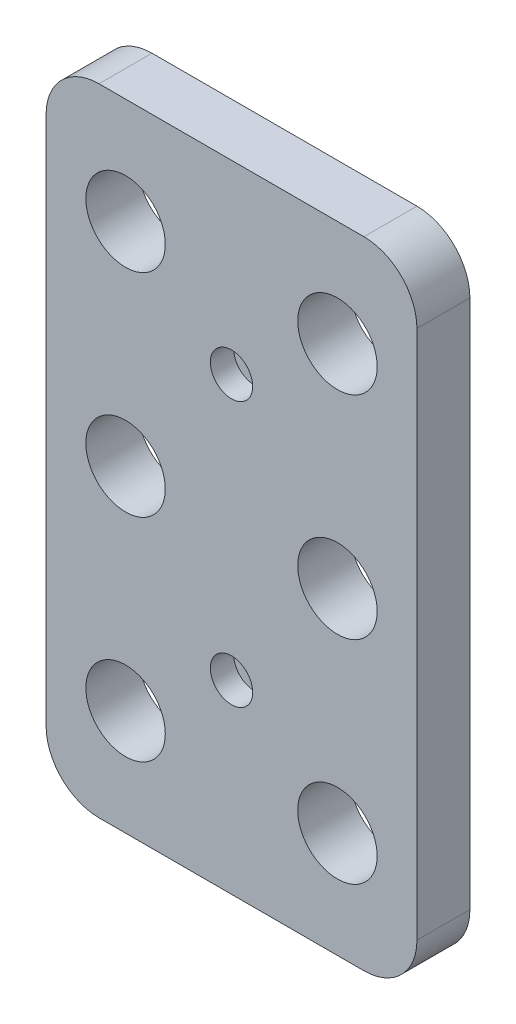
from build123d import *

# Parameters (mm, degrees)
SKETCH_1_R          = 7.5
SKETCH_1_R_2        = 2.25
EXTRUDE_1_DEPTH     = 10
SKETCH_2_R          = 4
CUT_EXTRUDE_1_DEPTH = 4.4
SHELL_1_T           = -3


with BuildPart() as part:
    # 草图1 → 凸台-拉伸1 (new body)
    with BuildSketch(Plane.XY):
        with BuildLine():
            Line((-25, -60), (25, -60))
            ThreePointArc((25, -60), (32.071067812, -57.071067812), (35, -50))
            Line((35, -50), (35, 50))
            ThreePointArc((35, 50), (32.071067812, 57.071067812), (25, 60))
            Line((25, 60), (-25, 60))
            ThreePointArc((-25, 60), (-32.071067812, 57.071067812), (-35, 50))
            Line((-35, 50), (-35, -50))
            ThreePointArc((-35, -50), (-32.071067812, -57.071067812), (-25, -60))
        make_face()
        with Locations((20, 40)):
            Circle(SKETCH_1_R, mode=Mode.SUBTRACT)
        with Locations((20, 0)):
            Circle(SKETCH_1_R, mode=Mode.SUBTRACT)
        with Locations(Location((20, -40, 0), (0, 0, 180))):
            Circle(SKETCH_1_R, mode=Mode.SUBTRACT)
        with Locations((-20, -40)):
            Circle(SKETCH_1_R, mode=Mode.SUBTRACT)
        with Locations(Location((-20, 0, 0), (0, 0, 180))):
            Circle(SKETCH_1_R, mode=Mode.SUBTRACT)
        with Locations(Location((-20, 40, 0), (0, 0, 180))):
            Circle(SKETCH_1_R, mode=Mode.SUBTRACT)
        with Locations((0, 25)):
            Circle(SKETCH_1_R_2, mode=Mode.SUBTRACT)
        with Locations(Location((0, -25, 0), (0, 0, 180))):
            Circle(SKETCH_1_R_2, mode=Mode.SUBTRACT)
    extrude(amount=EXTRUDE_1_DEPTH)

    # 草图2 → 切除-拉伸1 (cut)
    with BuildSketch(Plane.XY.offset(10)):
        with Locations((0, 25)):
            Circle(SKETCH_2_R)
        with Locations((0, -25)):
            Circle(SKETCH_2_R)
    extrude(amount=-CUT_EXTRUDE_1_DEPTH, mode=Mode.SUBTRACT)

    # 抽壳1
    shell_1_openings = [part.faces().sort_by_distance(p)[0] for p in [
        (0, 0, 0),
    ]]
    offset(amount=SHELL_1_T, openings=shell_1_openings, kind=Kind.INTERSECTION)


solid = part.part
